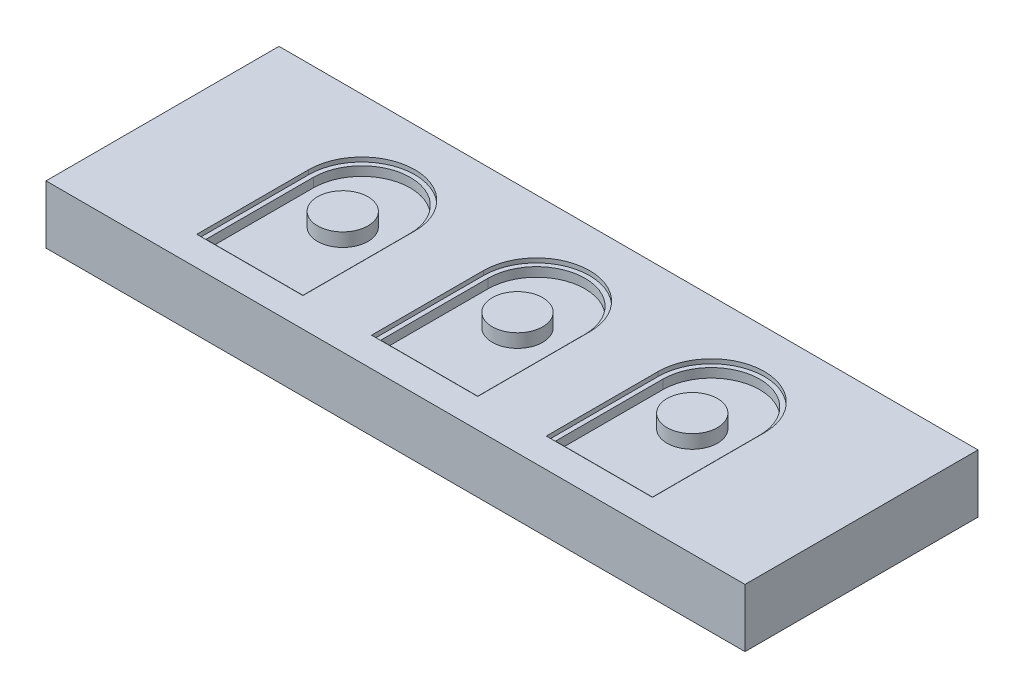
from build123d import *

# Parameters (mm, degrees)
SKETCH1_W            = 152.4
SKETCH1_H            = 50.8
BOSS_EXTRUDE1_DEPTH  = 12.7
CUT_EXTRUDE1_DEPTH   = 0.95
CUT_EXTRUDE2_DEPTH   = 2
SKETCH4_R            = 5.5
BOSS_EXTRUDE2_DEPTH  = 2.95
LPATTERN1_COUNT      = 2
LPATTERN1_PITCH      = 38.1
LPATTERN1_COUNT_DIR2 = 2
LPATTERN1_PITCH_DIR2 = 38.1


with BuildPart() as part:
    # Sketch1 → Boss-Extrude1 (new body)
    with BuildSketch(Plane(origin=(0, 0, 0), x_dir=(1, 0, 0), z_dir=(0, 1, 0))):
        with Locations((76.2, 25.4)):
            Rectangle(SKETCH1_W, SKETCH1_H)
    extrude(amount=BOSS_EXTRUDE1_DEPTH)

    # Sketch2 → Cut-Extrude1 (cut)
    with BuildSketch(Plane(origin=(0, 12.7, 0), x_dir=(1, 0, 0), z_dir=(0, 1, 0))):
        with BuildLine():
            Line((64.626998, 30.75), (64.626998, 6.35))
            Line((64.626998, 6.35), (87.773002, 6.35))
            Line((87.773002, 6.35), (87.773002, 30.75))
            ThreePointArc((87.773002, 30.75), (76.2, 42.323002), (64.626998, 30.75))
        make_face()
    cut_extrude1 = extrude(amount=-CUT_EXTRUDE1_DEPTH, mode=Mode.SUBTRACT)

    # Sketch3 → Cut-Extrude2 (cut)
    with BuildSketch(Plane(origin=(0, 11.75, 0), x_dir=(1, 0, 0), z_dir=(0, 1, 0))):
        with BuildLine():
            Line((65.626998, 30.75), (65.626998, 7.35))
            Line((65.626998, 7.35), (86.773002, 7.35))
            Line((86.773002, 7.35), (86.773002, 30.75))
            ThreePointArc((86.773002, 30.75), (76.2, 41.323002), (65.626998, 30.75))
        make_face()
    cut_extrude2 = extrude(amount=-CUT_EXTRUDE2_DEPTH, mode=Mode.SUBTRACT)

    # Sketch4 → Boss-Extrude2 (add)
    with BuildSketch(Plane(origin=(0, 9.75, 0), x_dir=(1, 0, 0), z_dir=(0, 1, 0))):
        with Locations(Location((76.2, 26.6, 0), (0, 0, 90))):
            Circle(SKETCH4_R)
    boss_extrude2 = extrude(amount=BOSS_EXTRUDE2_DEPTH)

    # LPattern1: Cut-Extrude1, Cut-Extrude2, Boss-Extrude2 2 × 2
    with Locations(*[Vector(1, 0, 0) * (i * LPATTERN1_PITCH) + Vector(-1, 0, 0) * (j * LPATTERN1_PITCH_DIR2) for i in range(LPATTERN1_COUNT) for j in range(LPATTERN1_COUNT_DIR2) if (i, j) != (0, 0)]):
        add(cut_extrude1, mode=Mode.SUBTRACT)
        add(cut_extrude2, mode=Mode.SUBTRACT)
        add(boss_extrude2)


solid = part.part
